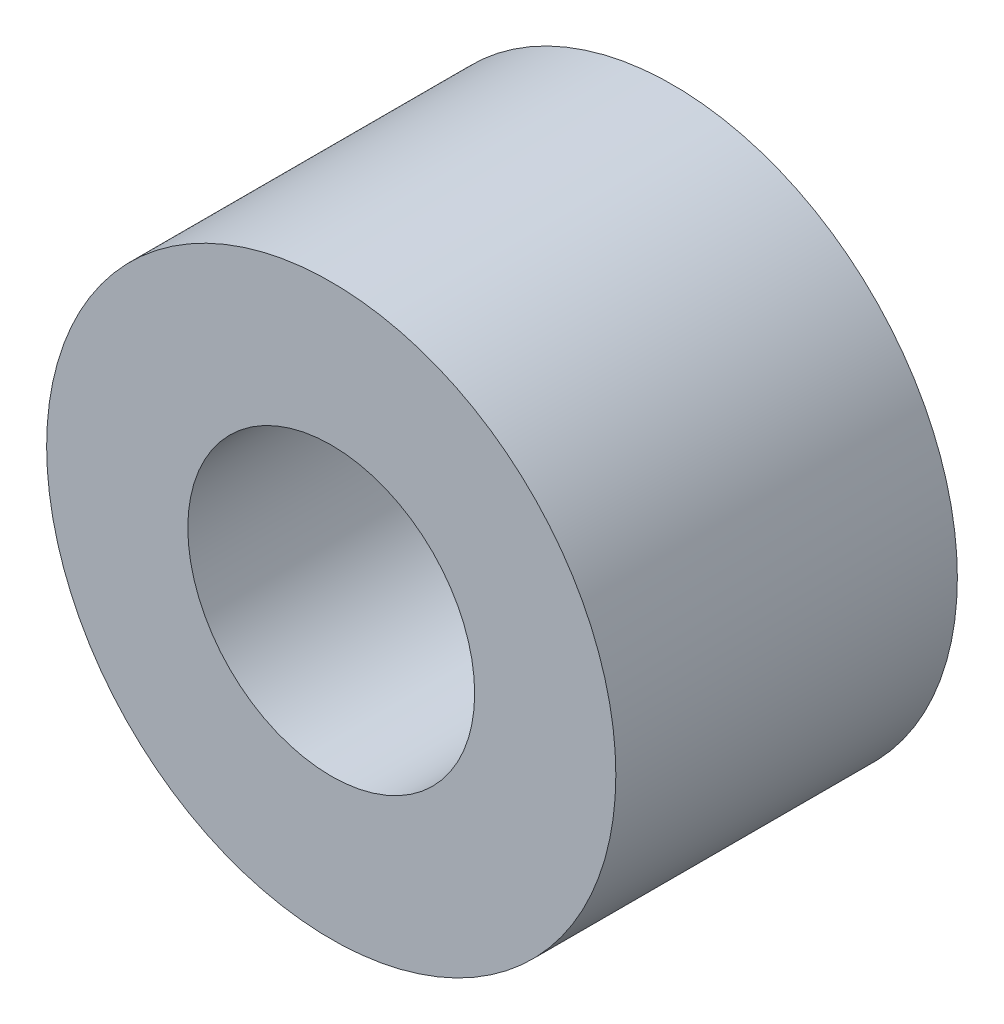
from build123d import *

# Parameters (mm, degrees)
SKETCH1_R           = 7.9375
SKETCH1_R_2         = 4
BOSS_EXTRUDE1_DEPTH = 9.525


with BuildPart() as part:
    # Sketch1 → Boss-Extrude1 (new body)
    with BuildSketch(Plane.XY):
        Circle(SKETCH1_R)
        Circle(SKETCH1_R_2, mode=Mode.SUBTRACT)
    extrude(amount=BOSS_EXTRUDE1_DEPTH)


solid = part.part
